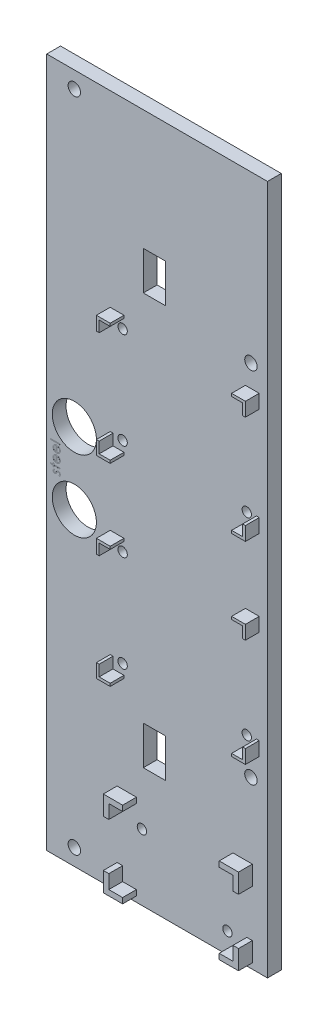
from build123d import *

# Parameters (mm, degrees)
SKETCH_1_W          = 80
SKETCH_1_H          = 250
EXTRUDE_1_DEPTH     = 5
SKETCH_2_W          = 3.589743589
SKETCH_2_H          = 0.314102564
TEMP_DEPTH          = 0.01
EXTRUDE_2_DEPTH     = 5
SKETCH_4_W          = 8
SKETCH_4_H          = 14
CUT_EXTRUDE_1_DEPTH = 10
HOLE_WIZARD_M3_1_D  = 3.4
EXTRUDE_3_DEPTH     = 5
HOLE_WIZARD_M3_2_D  = 3.4
HOLE_WIZARD_M4_1_D  = 4.5
SKETCH_16_R         = 8
CUT_EXTRUDE_2_DEPTH = 10


with BuildPart() as part:
    # 스케치1 → 보스-돌출1 (new body)
    with BuildSketch(Plane.XY):
        Rectangle(SKETCH_1_W, SKETCH_1_H)
    extrude(amount=EXTRUDE_1_DEPTH)

    # 스케치2 → temp (cut)
    # profile 1 of 5: a face of its own
    with BuildSketch(Plane(origin=(0, 0, 5), x_dir=(-1, 0, 0), z_dir=(0, 0, -1))):
        with Locations((36.897153237, 4.868589744)):
            Rectangle(SKETCH_2_W, SKETCH_2_H)
    # profile 2 of 5: a face of its own
    with BuildSketch(Plane(origin=(0, 0, 5), x_dir=(-1, 0, 0), z_dir=(0, 0, -1))):
        with BuildLine():
            Line((35.909973749, 3.714543269), (35.763439294, 3.993589744))
            add(Edge.make_bspline(
                [(35.763439294, 3.993589744), (35.723999189, 3.971349949), (35.647264364, 3.928080117), (35.541788067, 3.853723428), (35.447226957, 3.775682471), (35.36504489, 3.69126565), (35.293792114, 3.601512681), (35.231862372, 3.506291719), (35.178507079, 3.405920949), (35.133793844, 3.300046556), (35.099373495, 3.18775382), (35.075072333, 3.068730383), (35.060048206, 2.942759426), (35.058303186, 2.856413171), (35.057409647, 2.812199519)],
                knots=[0, 0, 0, 0, 1.120373846, 2.179803828, 3.190307243, 4.151866639, 5.090753574, 6.023181945, 6.960194942, 7.901556876, 8.864247182, 9.862852693, 10.905672442, 12, 12, 12, 12], degree=3))
            add(Edge.make_bspline(
                [(35.057409647, 2.812199519), (35.058556822, 2.763057542), (35.060794629, 2.667195781), (35.080087092, 2.527656031), (35.111559455, 2.396276623), (35.155524981, 2.273064881), (35.212952362, 2.158322769), (35.282911633, 2.051821392), (35.365044685, 1.953003844), (35.460058102, 1.864972125), (35.561751289, 1.785756106), (35.667666584, 1.715729573), (35.777857851, 1.657594181), (35.890611408, 1.608705044), (36.006964914, 1.571663509), (36.126280672, 1.544549038), (36.249149903, 1.529216946), (36.332242671, 1.526839243), (36.374116378, 1.525641026)],
                knots=[0, 0, 0, 0, 1.145226127, 2.234004399, 3.276654467, 4.290038057, 5.276870678, 6.260645262, 7.254731018, 8.264593254, 9.273837991, 10.257612574, 11.220387342, 12.174754112, 13.118989047, 14.062768009, 15.023752772, 16, 16, 16, 16], degree=3))
            add(Edge.make_bspline(
                [(36.374116378, 1.525641026), (36.413411208, 1.526700167), (36.491288373, 1.528799245), (36.606553917, 1.542030033), (36.71858237, 1.565478326), (36.827466818, 1.59765465), (36.933024952, 1.639205896), (37.035321015, 1.690038115), (37.134246155, 1.750230493), (37.196649289, 1.796703167), (37.228082724, 1.820112179)],
                knots=[0, 0, 0, 0, 1.024358464, 2.0301432, 3.019427413, 4.004406732, 4.986367066, 5.972626655, 6.978780325, 8, 8, 8, 8], degree=3))
            add(Edge.make_bspline(
                [(37.228082724, 1.820112179), (37.265951594, 1.851819862), (37.340489744, 1.914230809), (37.43842807, 2.019787164), (37.520471845, 2.134087361), (37.588478981, 2.255698987), (37.640152628, 2.386035461), (37.678660211, 2.523344752), (37.700238222, 2.669190338), (37.703286055, 2.768895559), (37.704845544, 2.819911859)],
                knots=[0, 0, 0, 0, 1.030682036, 2.02871468, 2.997146059, 3.962720338, 4.930598197, 5.918074684, 6.934738563, 8, 8, 8, 8], degree=3))
            add(Edge.make_bspline(
                [(37.704845544, 2.819911859), (37.703491495, 2.872359464), (37.70083516, 2.97524971), (37.676208827, 3.125281831), (37.637156272, 3.267242548), (37.582002482, 3.401075052), (37.51084293, 3.526792913), (37.422701088, 3.643578962), (37.320283001, 3.753430475), (37.241519792, 3.817339054), (37.201440095, 3.849859776)],
                knots=[0, 0, 0, 0, 1.056321875, 2.072262726, 3.055038591, 4.01806755, 4.982017516, 5.957941055, 6.960871419, 8, 8, 8, 8], degree=3))
            add(Edge.make_bspline(
                [(37.201440095, 3.849859776), (37.171236514, 3.871986714), (37.111030395, 3.916093307), (37.012859238, 3.971340407), (36.910148644, 4.019297802), (36.801238347, 4.057630763), (36.687418767, 4.088670264), (36.567876222, 4.111127083), (36.442646311, 4.124296702), (36.357319755, 4.126885399), (36.313819903, 4.128205128)],
                knots=[0, 0, 0, 0, 0.94817472, 1.890038105, 2.849395472, 3.817997239, 4.812318967, 5.836947057, 6.897266129, 8, 8, 8, 8], degree=3))
            Line((36.313819903, 4.128205128), (36.313819903, 1.83974359))
            add(Edge.make_bspline(
                [(36.313819903, 1.83974359), (36.280120121, 1.841284658), (36.213850857, 1.844315107), (36.116870386, 1.858409469), (36.024532151, 1.880733547), (35.937229583, 1.911764664), (35.854676038, 1.950674482), (35.776302568, 1.996839875), (35.703299422, 2.052252985), (35.634720571, 2.113957579), (35.573671128, 2.182674082), (35.518986686, 2.254940688), (35.473407048, 2.331705913), (35.435852932, 2.412195895), (35.406948769, 2.496828061), (35.38704438, 2.585483396), (35.373747247, 2.677886111), (35.372266204, 2.74087121), (35.371512211, 2.772936699)],
                knots=[0, 0, 0, 0, 1.094405546, 2.152104367, 3.174987145, 4.173015398, 5.153654967, 6.133208507, 7.119289451, 8.123438607, 9.122504012, 10.097966803, 11.060604936, 12.014205423, 12.976096155, 13.956823727, 14.959826266, 16, 16, 16, 16], degree=3))
            add(Edge.make_bspline(
                [(35.371512211, 2.772936699), (35.372116039, 2.804288645), (35.373314149, 2.86649692), (35.385137311, 2.959353444), (35.403941911, 3.050757572), (35.429788021, 3.140052795), (35.461627252, 3.225297606), (35.499792256, 3.304468818), (35.541527279, 3.377833151), (35.590011313, 3.446005912), (35.648741902, 3.512130903), (35.722872007, 3.576900758), (35.809644929, 3.647288238), (35.875219735, 3.691246052), (35.909973749, 3.714543269)],
                knots=[0, 0, 0, 0, 0.990963276, 1.966261236, 2.95471375, 3.93937425, 4.902926125, 5.828461241, 6.715766441, 7.568835615, 8.469155523, 9.505141836, 10.677749234, 12, 12, 12, 12], degree=3))
        make_face()
        with BuildLine():
            add(Edge.make_bspline(
                [(36.627922467, 3.814102564), (36.66959541, 3.802625546), (36.749802409, 3.780535979), (36.860607675, 3.734082223), (36.959655697, 3.682955179), (37.045311049, 3.621244249), (37.120854672, 3.550720669), (37.187539509, 3.470122211), (37.24691063, 3.379638582), (37.297076307, 3.279893019), (37.339762523, 3.17424748), (37.368388614, 3.063642293), (37.3879979, 2.950784241), (37.389824043, 2.87444999), (37.39074298, 2.83603766)],
                knots=[0, 0, 0, 0, 1.154756201, 2.222533969, 3.206705588, 4.129403772, 5.035894089, 5.963342549, 6.920206228, 7.923656548, 8.944970878, 9.96070521, 10.973801891, 12, 12, 12, 12], degree=3))
            add(Edge.make_bspline(
                [(37.39074298, 2.83603766), (37.390128727, 2.80468909), (37.388914477, 2.742719556), (37.377481649, 2.651405948), (37.358337568, 2.563553898), (37.332842628, 2.478679687), (37.297715767, 2.398260643), (37.257363412, 2.320203983), (37.207786601, 2.246437797), (37.170032541, 2.200294567), (37.150959326, 2.176983173)],
                knots=[0, 0, 0, 0, 1.048700258, 2.073059931, 3.073189922, 4.055269162, 5.032885305, 6.005420607, 6.992345662, 8, 8, 8, 8], degree=3))
            add(Edge.make_bspline(
                [(37.150959326, 2.176983173), (37.135865011, 2.160289891), (37.105317795, 2.126506757), (37.052688588, 2.081366235), (36.995937026, 2.038145763), (36.932891901, 1.99881211), (36.864271122, 1.962734523), (36.790653487, 1.928974546), (36.711480357, 1.898588134), (36.656307918, 1.881492024), (36.627922467, 1.872696314)],
                knots=[0, 0, 0, 0, 0.879870761, 1.780643979, 2.707998968, 3.669668524, 4.684282772, 5.740141944, 6.837334558, 8, 8, 8, 8], degree=3))
            Line((36.627922467, 1.872696314), (36.627922467, 3.814102564))
        make_face(mode=Mode.SUBTRACT)
    # profile 3 of 5: a face of its own
    with BuildSketch(Plane(origin=(0, 0, 5), x_dir=(-1, 0, 0), z_dir=(0, 0, -1))):
        with BuildLine():
            Line((35.909973749, 0.573517628), (35.763439294, 0.852564103))
            add(Edge.make_bspline(
                [(35.763439294, 0.852564103), (35.723999189, 0.830324308), (35.647264364, 0.787054476), (35.541788067, 0.712697787), (35.447226957, 0.63465683), (35.36504489, 0.550240009), (35.293792114, 0.46048704), (35.231862372, 0.365266077), (35.178507079, 0.264895308), (35.133793844, 0.159020915), (35.099373495, 0.046728179), (35.075072333, -0.072295258), (35.060048206, -0.198266215), (35.058303186, -0.28461247), (35.057409647, -0.328826122)],
                knots=[0, 0, 0, 0, 1.120373846, 2.179803828, 3.190307243, 4.151866639, 5.090753574, 6.023181945, 6.960194942, 7.901556876, 8.864247182, 9.862852693, 10.905672442, 12, 12, 12, 12], degree=3))
            add(Edge.make_bspline(
                [(35.057409647, -0.328826122), (35.058556822, -0.377968099), (35.060794629, -0.47382986), (35.080087092, -0.613369611), (35.111559455, -0.744749018), (35.155524981, -0.86796076), (35.212952362, -0.982702872), (35.282911633, -1.089204249), (35.365044685, -1.188021797), (35.460058102, -1.276053516), (35.561751289, -1.355269535), (35.667666584, -1.425296068), (35.777857851, -1.48343146), (35.890611408, -1.532320597), (36.006964914, -1.569362132), (36.126280672, -1.596476603), (36.249149903, -1.611808695), (36.332242671, -1.614186398), (36.374116378, -1.615384615)],
                knots=[0, 0, 0, 0, 1.145226127, 2.234004399, 3.276654467, 4.290038057, 5.276870678, 6.260645262, 7.254731018, 8.264593254, 9.273837991, 10.257612574, 11.220387342, 12.174754112, 13.118989047, 14.062768009, 15.023752772, 16, 16, 16, 16], degree=3))
            add(Edge.make_bspline(
                [(36.374116378, -1.615384615), (36.413411208, -1.614325474), (36.491288373, -1.612226396), (36.606553917, -1.598995608), (36.71858237, -1.575547315), (36.827466818, -1.543370991), (36.933024952, -1.501819745), (37.035321015, -1.450987526), (37.134246155, -1.390795148), (37.196649289, -1.344322474), (37.228082724, -1.320913462)],
                knots=[0, 0, 0, 0, 1.024358464, 2.0301432, 3.019427413, 4.004406732, 4.986367066, 5.972626655, 6.978780325, 8, 8, 8, 8], degree=3))
            add(Edge.make_bspline(
                [(37.228082724, -1.320913462), (37.265951594, -1.289205779), (37.340489744, -1.226794832), (37.43842807, -1.121238477), (37.520471845, -1.00693828), (37.588478981, -0.885326654), (37.640152628, -0.75499018), (37.678660211, -0.617680889), (37.700238222, -0.471835303), (37.703286055, -0.372130082), (37.704845544, -0.321113782)],
                knots=[0, 0, 0, 0, 1.030682036, 2.02871468, 2.997146059, 3.962720338, 4.930598197, 5.918074684, 6.934738563, 8, 8, 8, 8], degree=3))
            add(Edge.make_bspline(
                [(37.704845544, -0.321113782), (37.703491495, -0.268666177), (37.70083516, -0.165775931), (37.676208827, -0.01574381), (37.637156272, 0.126216907), (37.582002482, 0.260049411), (37.51084293, 0.385767272), (37.422701088, 0.502553321), (37.320283001, 0.612404834), (37.241519792, 0.676313413), (37.201440095, 0.708834135)],
                knots=[0, 0, 0, 0, 1.056321875, 2.072262726, 3.055038591, 4.01806755, 4.982017516, 5.957941055, 6.960871419, 8, 8, 8, 8], degree=3))
            add(Edge.make_bspline(
                [(37.201440095, 0.708834135), (37.171236514, 0.730961073), (37.111030395, 0.775067666), (37.012859238, 0.830314766), (36.910148644, 0.878272161), (36.801238347, 0.916605122), (36.687418767, 0.947644623), (36.567876222, 0.970101442), (36.442646311, 0.983271061), (36.357319755, 0.985859758), (36.313819903, 0.987179487)],
                knots=[0, 0, 0, 0, 0.94817472, 1.890038105, 2.849395472, 3.817997239, 4.812318967, 5.836947057, 6.897266129, 8, 8, 8, 8], degree=3))
            Line((36.313819903, 0.987179487), (36.313819903, -1.301282051))
            add(Edge.make_bspline(
                [(36.313819903, -1.301282051), (36.280120121, -1.299740983), (36.213850857, -1.296710534), (36.116870386, -1.282616172), (36.024532151, -1.260292094), (35.937229583, -1.229260977), (35.854676038, -1.190351159), (35.776302568, -1.144185766), (35.703299422, -1.088772656), (35.634720571, -1.027068062), (35.573671128, -0.958351559), (35.518986686, -0.886084953), (35.473407048, -0.809319728), (35.435852932, -0.728829746), (35.406948769, -0.64419758), (35.38704438, -0.555542245), (35.373747247, -0.46313953), (35.372266204, -0.400154431), (35.371512211, -0.368088942)],
                knots=[0, 0, 0, 0, 1.094405546, 2.152104367, 3.174987145, 4.173015398, 5.153654967, 6.133208507, 7.119289451, 8.123438607, 9.122504012, 10.097966803, 11.060604936, 12.014205423, 12.976096155, 13.956823727, 14.959826266, 16, 16, 16, 16], degree=3))
            add(Edge.make_bspline(
                [(35.371512211, -0.368088942), (35.372116039, -0.336736996), (35.373314149, -0.274528721), (35.385137311, -0.181672197), (35.403941911, -0.090268069), (35.429788021, -0.000972846), (35.461627252, 0.084271965), (35.499792256, 0.163443177), (35.541527279, 0.236807509), (35.590011313, 0.304980271), (35.648741902, 0.371105262), (35.722872007, 0.435875117), (35.809644929, 0.506262597), (35.875219735, 0.550220411), (35.909973749, 0.573517628)],
                knots=[0, 0, 0, 0, 0.990963276, 1.966261236, 2.95471375, 3.93937425, 4.902926125, 5.828461241, 6.715766441, 7.568835615, 8.469155523, 9.505141836, 10.677749234, 12, 12, 12, 12], degree=3))
        make_face()
        with BuildLine():
            add(Edge.make_bspline(
                [(36.627922467, 0.673076923), (36.66959541, 0.661599905), (36.749802409, 0.639510338), (36.860607675, 0.593056582), (36.959655697, 0.541929538), (37.045311049, 0.480218608), (37.120854672, 0.409695028), (37.187539509, 0.32909657), (37.24691063, 0.238612941), (37.297076307, 0.138867378), (37.339762523, 0.033221839), (37.368388614, -0.077383348), (37.3879979, -0.1902414), (37.389824043, -0.266575651), (37.39074298, -0.304987981)],
                knots=[0, 0, 0, 0, 1.154756201, 2.222533969, 3.206705588, 4.129403772, 5.035894089, 5.963342549, 6.920206228, 7.923656548, 8.944970878, 9.96070521, 10.973801891, 12, 12, 12, 12], degree=3))
            add(Edge.make_bspline(
                [(37.39074298, -0.304987981), (37.390128727, -0.336336551), (37.388914477, -0.398306085), (37.377481649, -0.489619693), (37.358337568, -0.577471743), (37.332842628, -0.662345954), (37.297715767, -0.742764998), (37.257363412, -0.820821658), (37.207786601, -0.894587844), (37.170032541, -0.940731074), (37.150959326, -0.964042468)],
                knots=[0, 0, 0, 0, 1.048700258, 2.073059931, 3.073189922, 4.055269162, 5.032885305, 6.005420607, 6.992345662, 8, 8, 8, 8], degree=3))
            add(Edge.make_bspline(
                [(37.150959326, -0.964042468), (37.135865011, -0.98073575), (37.105317795, -1.014518884), (37.052688588, -1.059659406), (36.995937026, -1.102879878), (36.932891901, -1.142213531), (36.864271122, -1.178291118), (36.790653487, -1.212051095), (36.711480357, -1.242437507), (36.656307918, -1.259533617), (36.627922467, -1.268329327)],
                knots=[0, 0, 0, 0, 0.879870761, 1.780643979, 2.707998968, 3.669668524, 4.684282772, 5.740141944, 6.837334558, 8, 8, 8, 8], degree=3))
            Line((36.627922467, -1.268329327), (36.627922467, 0.673076923))
        make_face(mode=Mode.SUBTRACT)
    # profile 4 of 5: a face of its own
    with BuildSketch(Plane(origin=(0, 0, 5), x_dir=(-1, 0, 0), z_dir=(0, 0, -1))):
        Polygon((38.692025031, -2.871794872), (38.692025031, -2.557692308), (37.659973749, -2.557692308), (37.659973749, -2.108974359), (37.345871185, -2.108974359), (37.345871185, -2.557692308), (35.102281442, -2.557692308), (35.102281442, -2.871794872), (37.345871185, -2.871794872), (37.345871185, -3.320512821), (37.659973749, -3.320512821), (37.659973749, -2.871794872), align=None)
    # profile 5 of 5: a face of its own
    with BuildSketch(Plane(origin=(0, 0, 5), x_dir=(-1, 0, 0), z_dir=(0, 0, -1))):
        with BuildLine():
            Line((37.340963333, -3.858974359), (37.121512211, -4.072115385))
            add(Edge.make_bspline(
                [(37.121512211, -4.072115385), (37.142829965, -4.090502871), (37.183928085, -4.12595178), (37.238803673, -4.182223517), (37.285271705, -4.238259277), (37.323506944, -4.293763513), (37.35359843, -4.348839804), (37.37485173, -4.403958396), (37.388194475, -4.458968036), (37.389903681, -4.495757023), (37.39074298, -4.513822115)],
                knots=[0, 0, 0, 0, 1.265880991, 2.440469525, 3.530740057, 4.536711111, 5.468008477, 6.34654737, 7.188078389, 8, 8, 8, 8], degree=3))
            add(Edge.make_bspline(
                [(37.39074298, -4.513822115), (37.389657622, -4.53595532), (37.387521792, -4.579510335), (37.366625487, -4.64183119), (37.333780003, -4.699281042), (37.288122909, -4.7494369), (37.23508842, -4.791694932), (37.176511171, -4.823724148), (37.112826752, -4.842479812), (37.068814654, -4.844917484), (37.046492179, -4.846153846)],
                knots=[0, 0, 0, 0, 1.000196853, 1.968245854, 2.94569445, 3.981000421, 5.021494845, 6.007172807, 6.989258906, 8, 8, 8, 8], degree=3))
            add(Edge.make_bspline(
                [(37.046492179, -4.846153846), (37.026280135, -4.845043034), (36.985913024, -4.842824541), (36.92636499, -4.825577862), (36.868307952, -4.798111789), (36.832745045, -4.772441595), (36.814420865, -4.759214744)],
                knots=[0, 0, 0, 0, 0.960159726, 1.917612774, 2.927026955, 4, 4, 4, 4], degree=3))
            add(Edge.make_bspline(
                [(36.814420865, -4.759214744), (36.80463628, -4.75125125), (36.783811026, -4.734301957), (36.754907172, -4.702493442), (36.722964921, -4.666470939), (36.691028084, -4.623151001), (36.657396359, -4.574399974), (36.623394226, -4.519160689), (36.586429801, -4.459186184), (36.562985366, -4.416248878), (36.55079907, -4.393930288)],
                knots=[0, 0, 0, 0, 0.66740084, 1.420478572, 2.27185888, 3.217733974, 4.268547843, 5.408967954, 6.65319498, 8, 8, 8, 8], degree=3))
            add(Edge.make_bspline(
                [(36.55079907, -4.393930288), (36.535554167, -4.366716711), (36.506106035, -4.314149041), (36.460396331, -4.239456274), (36.414964907, -4.171669233), (36.370297633, -4.110213565), (36.325144765, -4.056271757), (36.281237008, -4.008207204), (36.2372477, -3.96721876), (36.206514586, -3.944264833), (36.191824711, -3.933293269)],
                knots=[0, 0, 0, 0, 1.27191281, 2.456916733, 3.569705269, 4.599008579, 5.553216877, 6.436649441, 7.252746552, 8, 8, 8, 8], degree=3))
            add(Edge.make_bspline(
                [(36.191824711, -3.933293269), (36.162190908, -3.914991464), (36.103286622, -3.878612241), (36.005633409, -3.841899714), (35.902911156, -3.818434372), (35.832280997, -3.815562059), (35.796392019, -3.814102564)],
                knots=[0, 0, 0, 0, 0.995606783, 1.979007074, 2.973082153, 4, 4, 4, 4], degree=3))
            add(Edge.make_bspline(
                [(35.796392019, -3.814102564), (35.771122055, -3.814820447), (35.721324831, -3.816235113), (35.648001733, -3.826116875), (35.577824046, -3.842984742), (35.510381122, -3.866364495), (35.445804421, -3.896345462), (35.384580392, -3.934026677), (35.326189048, -3.977716272), (35.270958611, -4.027158131), (35.220849552, -4.082071009), (35.177255307, -4.141119147), (35.140437266, -4.203413291), (35.110211603, -4.268968636), (35.086132535, -4.337924514), (35.069472975, -4.410337941), (35.059499405, -4.485966113), (35.058115041, -4.537396002), (35.057409647, -4.563601763)],
                knots=[0, 0, 0, 0, 1.032633728, 2.034917567, 3.017159222, 3.977707287, 4.947659047, 5.920662675, 6.910168127, 7.92466491, 8.94557085, 9.942744688, 10.919024275, 11.897637117, 12.88838639, 13.898512555, 14.929200919, 16, 16, 16, 16], degree=3))
            add(Edge.make_bspline(
                [(35.057409647, -4.563601763), (35.058402347, -4.598968938), (35.060373954, -4.669211865), (35.078880015, -4.773101584), (35.107675409, -4.874622343), (35.147391344, -4.973005883), (35.197542056, -5.066051997), (35.25760445, -5.151182922), (35.325594447, -5.228694384), (35.377707358, -5.272812658), (35.403763813, -5.294871795)],
                knots=[0, 0, 0, 0, 1.013940152, 2.01379169, 3.017749504, 4.037548394, 5.051665909, 6.043208538, 7.021604269, 8, 8, 8, 8], degree=3))
            Line((35.403763813, -5.294871795), (35.64074298, -5.086638622))
            add(Edge.make_bspline(
                [(35.64074298, -5.086638622), (35.619388216, -5.066866209), (35.577988776, -5.028534397), (35.522864435, -4.96723318), (35.476663164, -4.904853779), (35.438019749, -4.842019092), (35.408244346, -4.777798998), (35.387325752, -4.712553384), (35.37388156, -4.64641496), (35.372303277, -4.601992824), (35.371512211, -4.579727564)],
                knots=[0, 0, 0, 0, 1.179806542, 2.287233372, 3.337373186, 4.324005949, 5.273901747, 6.200048787, 7.097828587, 8, 8, 8, 8], degree=3))
            add(Edge.make_bspline(
                [(35.371512211, -4.579727564), (35.372883036, -4.549409638), (35.375561398, -4.490173497), (35.39987849, -4.405329738), (35.438008441, -4.326991111), (35.49209314, -4.258967766), (35.555048712, -4.201065605), (35.625962831, -4.159137431), (35.702754288, -4.132861255), (35.755986591, -4.129775256), (35.783070704, -4.128205128)],
                knots=[0, 0, 0, 0, 1.072336372, 2.095165389, 3.102688358, 4.141489647, 5.156069229, 6.117746104, 7.042326257, 8, 8, 8, 8], degree=3))
            add(Edge.make_bspline(
                [(35.783070704, -4.128205128), (35.805380323, -4.129291423), (35.849427679, -4.131436165), (35.91317802, -4.148279437), (35.9736473, -4.17489229), (36.009036948, -4.201096938), (36.027061089, -4.214443109)],
                knots=[0, 0, 0, 0, 1.013901739, 2.00181326, 2.98231254, 4, 4, 4, 4], degree=3))
            add(Edge.make_bspline(
                [(36.027061089, -4.214443109), (36.036096451, -4.222465503), (36.055778733, -4.239941176), (36.084203812, -4.271996417), (36.114841911, -4.310378279), (36.1471735, -4.355518442), (36.180772105, -4.407507904), (36.215461458, -4.46655738), (36.252889184, -4.531857932), (36.277708839, -4.578028563), (36.290682884, -4.602163462)],
                knots=[0, 0, 0, 0, 0.615000592, 1.339693406, 2.178160186, 3.116406724, 4.166410947, 5.330106347, 6.604359322, 8, 8, 8, 8], degree=3))
            add(Edge.make_bspline(
                [(36.290682884, -4.602163462), (36.305222016, -4.628210102), (36.333418032, -4.678722849), (36.377334112, -4.75027014), (36.422001387, -4.814817494), (36.464914226, -4.873918069), (36.50833517, -4.926079074), (36.552312421, -4.971095023), (36.595072408, -5.010738239), (36.625369704, -5.03268565), (36.639841538, -5.043169071)],
                knots=[0, 0, 0, 0, 1.262093308, 2.447601706, 3.550203992, 4.582594899, 5.537233252, 6.418365656, 7.244515135, 8, 8, 8, 8], degree=3))
            add(Edge.make_bspline(
                [(36.639841538, -5.043169071), (36.668987153, -5.06129967), (36.727288568, -5.097567205), (36.824599045, -5.132782397), (36.927044102, -5.156988425), (36.997730957, -5.159150816), (37.033871987, -5.16025641)],
                knots=[0, 0, 0, 0, 0.985009483, 1.970363186, 2.962279964, 4, 4, 4, 4], degree=3))
            add(Edge.make_bspline(
                [(37.033871987, -5.16025641), (37.057497331, -5.159722138), (37.103735476, -5.15867649), (37.171675055, -5.150333528), (37.236220442, -5.135137843), (37.298357328, -5.116097315), (37.356822742, -5.089561632), (37.412735609, -5.058045711), (37.465050606, -5.020014125), (37.514029147, -4.977266109), (37.558980361, -4.930794153), (37.597524691, -4.879896372), (37.630670707, -4.826394323), (37.658425304, -4.76997626), (37.679429556, -4.710158407), (37.693886155, -4.647343303), (37.703541573, -4.581662344), (37.704404627, -4.536761191), (37.704845544, -4.513822115)],
                knots=[0, 0, 0, 0, 1.087761869, 2.12890409, 3.144425528, 4.138218063, 5.116152125, 6.094559764, 7.089109474, 8.088306095, 9.085414286, 10.060442677, 11.0220762, 11.979848209, 12.949875201, 13.933947973, 14.944496518, 16, 16, 16, 16], degree=3))
            add(Edge.make_bspline(
                [(37.704845544, -4.513822115), (37.703743789, -4.486628717), (37.70151961, -4.431731802), (37.683773594, -4.349397991), (37.654873797, -4.267278731), (37.614022156, -4.185289857), (37.562640315, -4.10308206), (37.499396271, -4.021023827), (37.426075237, -3.937781965), (37.369967871, -3.885830511), (37.340963333, -3.858974359)],
                knots=[0, 0, 0, 0, 0.845753203, 1.707371858, 2.609134499, 3.549244224, 4.552329203, 5.621587647, 6.770486714, 8, 8, 8, 8], degree=3))
        make_face()
    extrude(amount=TEMP_DEPTH, mode=Mode.SUBTRACT)

    # 스케치3 → 보스-돌출2 (add)
    with BuildSketch(Plane.XY.offset(5)):
        Polygon((-12, -13), (-17, -13), (-17, -18), (-16, -18), (-16, -14), (-12, -14), align=None)
        Polygon((32, -14), (32, -13), (37, -13), (37, -18), (36, -18), (36, -14), align=None)
        Polygon((32, -57), (37, -57), (37, -52), (36, -52), (36, -56), (32, -56), align=None)
        Polygon((-12, -56), (-12, -57), (-17, -57), (-17, -52), (-16, -52), (-16, -56), align=None)
        Polygon((-12, 57), (-17, 57), (-17, 52), (-16, 52), (-16, 56), (-12, 56), align=None)
        Polygon((32, 56), (32, 57), (37, 57), (37, 52), (36, 52), (36, 56), align=None)
        Polygon((32, 13), (37, 13), (37, 18), (36, 18), (36, 14), (32, 14), align=None)
        Polygon((-12, 14), (-12, 13), (-17, 13), (-17, 18), (-16, 18), (-16, 14), align=None)
    extrude(amount=EXTRUDE_2_DEPTH)

    # 스케치4 → 컷-돌출1 (cut)
    with BuildSketch(Plane.XY.offset(5)):
        with Locations((-1, -74.5)):
            Rectangle(SKETCH_4_W, SKETCH_4_H)
        with Locations((-1, 74.5)):
            Rectangle(SKETCH_4_W, SKETCH_4_H)
    extrude(amount=-CUT_EXTRUDE_1_DEPTH, mode=Mode.SUBTRACT)

    # M3 여유 구멍1 (through all)
    with Locations(Plane.XY.offset(5)):
        with Locations((-12.5, 17.5), (32.5, 17.5), (32.5, 52.5), (-12.5, 52.5), (32.5, -17.5), (-12.5, -17.5), (-12.5, -52.5), (32.5, -52.5)):
            Hole(HOLE_WIZARD_M3_1_D / 2)

    # 스케치9 → 보스-돌출3 (add)
    with BuildSketch(Plane.XY.offset(5)):
        Polygon((-14.5, -123), (-14.5, -116), (-12.5, -116), (-12.5, -121), (-7.5, -121), (-7.5, -123), align=None)
        Polygon((27.5, -121), (27.5, -123), (34.5, -123), (34.5, -116), (32.5, -116), (32.5, -121), align=None)
        Polygon((34.5, -92), (34.5, -99), (32.5, -99), (32.5, -94), (27.5, -94), (27.5, -92), align=None)
        Polygon((-7.5, -94), (-7.5, -92), (-14.5, -92), (-14.5, -99), (-12.5, -99), (-12.5, -94), align=None)
    extrude(amount=EXTRUDE_3_DEPTH)

    # M3 여유 구멍2 (through all)
    with Locations(Plane.XY.offset(5)):
        with Locations((-5.5, -101), (25.5, -117.5)):
            Hole(HOLE_WIZARD_M3_2_D / 2)

    # M4 여유 구멍1 (through all)
    with Locations(Plane.XY.offset(5)):
        with Locations((-30, -119), (34, -65), (34, 65), (-30, 119)):
            Hole(HOLE_WIZARD_M4_1_D / 2)

    # 스케치16 → 컷-돌출2 (cut)
    with BuildSketch(Plane.XY.offset(5)):
        with Locations((-30, -13)):
            Circle(SKETCH_16_R)
        with Locations((-30, 13)):
            Circle(SKETCH_16_R)
    extrude(amount=-CUT_EXTRUDE_2_DEPTH, mode=Mode.SUBTRACT)


solid = part.part
